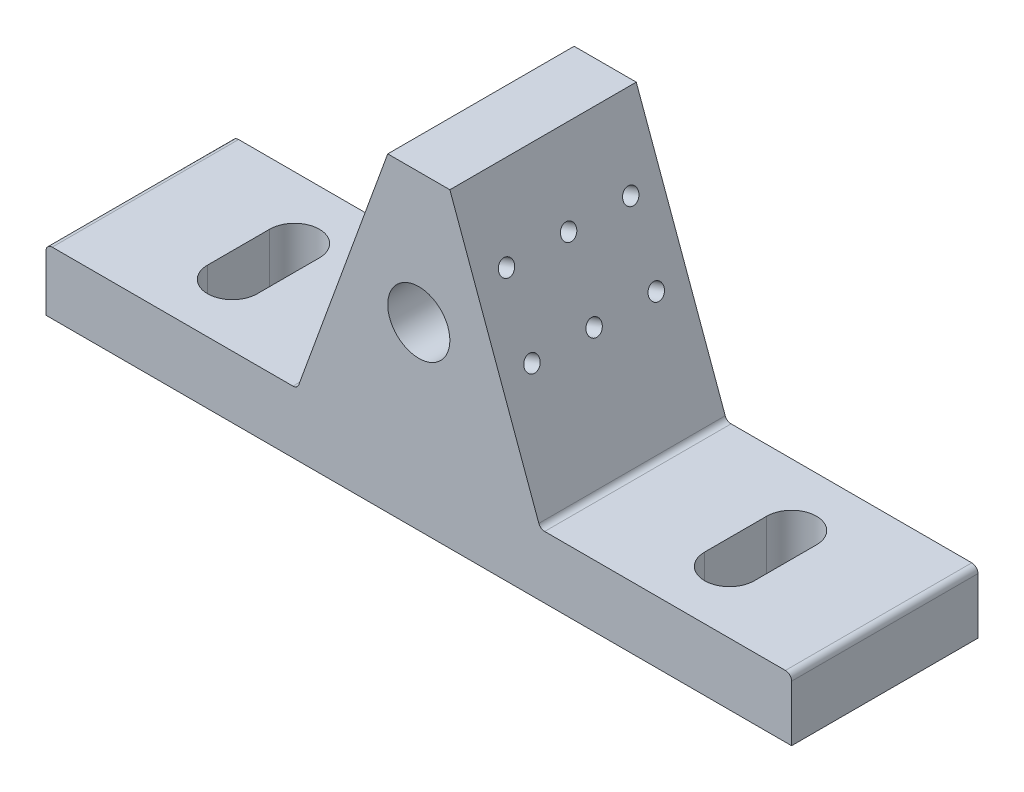
from build123d import *

# Parameters (mm, degrees)
BASE_EXTRUDE_DEPTH   = 15
SLOT_CUT_DEPTH       = 74.654599313
SKETCH3_R            = 5
GUIDE_HOLE_DEPTH     = 84.666002653
LPATTERN1_COUNT      = 3
LPATTERN1_PITCH      = 10
LPATTERN1_COUNT_DIR2 = 2
LPATTERN1_PITCH_DIR2 = 12
FILLET1_R            = 1


with BuildPart() as part:
    # Sketch1 → Base Extrude (new, symmetric)
    with BuildSketch(Plane.XY):
        Polygon((-60, 0), (60, 0), (60, 10), (19.558809371, 10), (5, 50), (-5, 50), (-19.558809371, 10), (-60, 10), align=None)
    extrude(amount=BASE_EXTRUDE_DEPTH, both=True)

    # Sketch2 → Slot Cut (cut, through all)
    with BuildSketch(Plane(origin=(0, 10, 0), x_dir=(1, 0, 0), z_dir=(0, 1, 0))):
        with BuildLine():
            Line((36, -5), (36, 5))
            ThreePointArc((36, 5), (40, 9), (44, 5))
            Line((44, 5), (44, -5))
            ThreePointArc((44, -5), (40, -9), (36, -5))
        make_face()
    slot_cut = extrude(amount=-SLOT_CUT_DEPTH, mode=Mode.SUBTRACT)

    # Mirror1: Slot Cut across plane
    add(slot_cut.mirror(Plane(origin=(0, 0, 0), x_dir=(0, 0, 1), z_dir=(1, 0, 0))), mode=Mode.SUBTRACT)

    # Sketch3 → Guide hole (cut, through all)
    with BuildSketch(Plane.XY.offset(15)):
        with Locations((0, 29)):
            Circle(SKETCH3_R)
    extrude(amount=-GUIDE_HOLE_DEPTH, mode=Mode.SUBTRACT)

    # Sketch10 → M3x0.5 Tapped Hole3 (revolve, cut)
    with BuildSketch(Plane(origin=(13.216501869, 27.425346647, 10), x_dir=(-0.3420201433256727, 0.939692620785907, 0), z_dir=(0, 0, 1))):
        Polygon((0, 0), (0, 8.251075774), (1.25, 7.5), (1.25, 0), align=None)
    m3x0_5_tapped_hole3 = revolve(axis=Axis((19.183550011, 29.597174557, 10), (-0.9396926207859069, -0.34202014332567277, 0)), mode=Mode.SUBTRACT)

    # LPattern1: M3x0.5 Tapped Hole3 3 × 2
    with Locations(*[Vector(0, 0, -1) * (i * LPATTERN1_PITCH) + Vector(-0.34202014332567315, 0.9396926207859069, 0) * (j * LPATTERN1_PITCH_DIR2) for i in range(LPATTERN1_COUNT) for j in range(LPATTERN1_COUNT_DIR2) if (i, j) != (0, 0)]):
        add(m3x0_5_tapped_hole3, mode=Mode.SUBTRACT)

    # Fillet1
    fillet1_edges = [part.edges().sort_by_distance(p)[0] for p in [
        (-60, 10, 0),
        (-19.558809371, 10, 0),
        (19.558809371, 10, 0),
        (60, 10, 0),
    ]]
    fillet(fillet1_edges, radius=FILLET1_R)


solid = part.part
